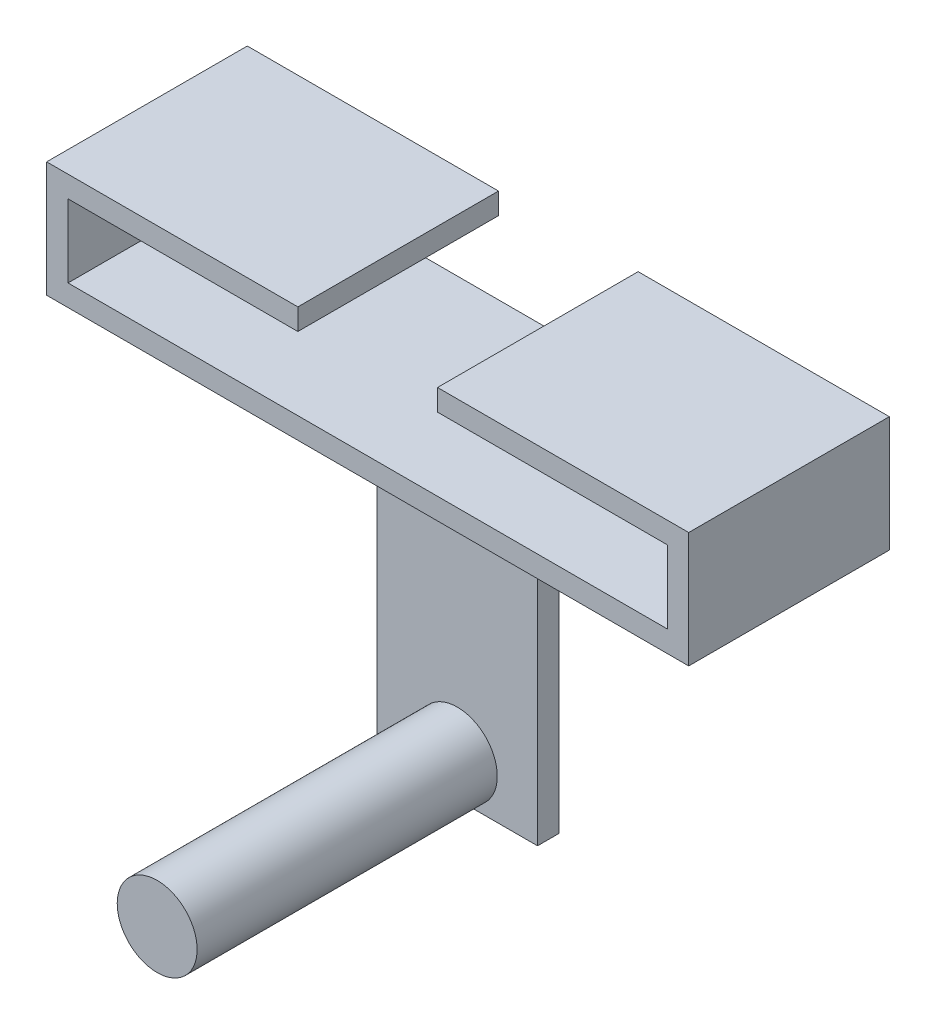
from build123d import *

# Parameters (mm, degrees)
SKETCH1_W           = 101.6
SKETCH1_H           = 31.75
BOSS_EXTRUDE1_DEPTH = 18.288
SKETCH2_W           = 22.098
SKETCH2_H           = 31.75
CUT_EXTRUDE1_DEPTH  = 14.9098
SKETCH3_W           = 36.3728
SKETCH3_H           = 11.5316
CUT_EXTRUDE2_DEPTH  = 109.004969534
SKETCH4_W           = 25.37968
SKETCH4_H           = 3.3782
BOSS_EXTRUDE2_DEPTH = 50.8
SKETCH5_R           = 6.3246
BOSS_EXTRUDE3_DEPTH = 47.498


with BuildPart() as part:
    # Sketch1 → Boss-Extrude1 (new body)
    with BuildSketch(Plane(origin=(0, 0, 0), x_dir=(1, 0, 0), z_dir=(0, 1, 0))):
        with Locations((50.8, 15.875)):
            Rectangle(SKETCH1_W, SKETCH1_H)
    extrude(amount=BOSS_EXTRUDE1_DEPTH)

    # Sketch2 → Cut-Extrude1 (cut)
    with BuildSketch(Plane(origin=(0, 18.288, 0), x_dir=(1, 0, 0), z_dir=(0, 1, 0))):
        with Locations((50.8, 15.875)):
            Rectangle(SKETCH2_W, SKETCH2_H)
    extrude(amount=-CUT_EXTRUDE1_DEPTH, mode=Mode.SUBTRACT)

    # Sketch3 → Cut-Extrude2 (cut, through all)
    with BuildSketch(Plane.XY):
        with Locations((21.5646, 9.144)):
            Rectangle(SKETCH3_W, SKETCH3_H)
        with Locations((80.0354, 9.144)):
            Rectangle(SKETCH3_W, SKETCH3_H)
    extrude(amount=-CUT_EXTRUDE2_DEPTH, mode=Mode.SUBTRACT)

    # Sketch4 → Boss-Extrude2 (add)
    with BuildSketch(Plane.XZ):
        with Locations((50.8, -15.875)):
            Rectangle(SKETCH4_W, SKETCH4_H)
    extrude(amount=BOSS_EXTRUDE2_DEPTH)

    # Sketch5 → Boss-Extrude3 (add)
    with BuildSketch(Plane.XY.offset(-14.1859)):
        with Locations(Location((50.8, -44.45, 0), (0, 0, 180))):
            Circle(SKETCH5_R)
    extrude(amount=BOSS_EXTRUDE3_DEPTH)


solid = part.part
